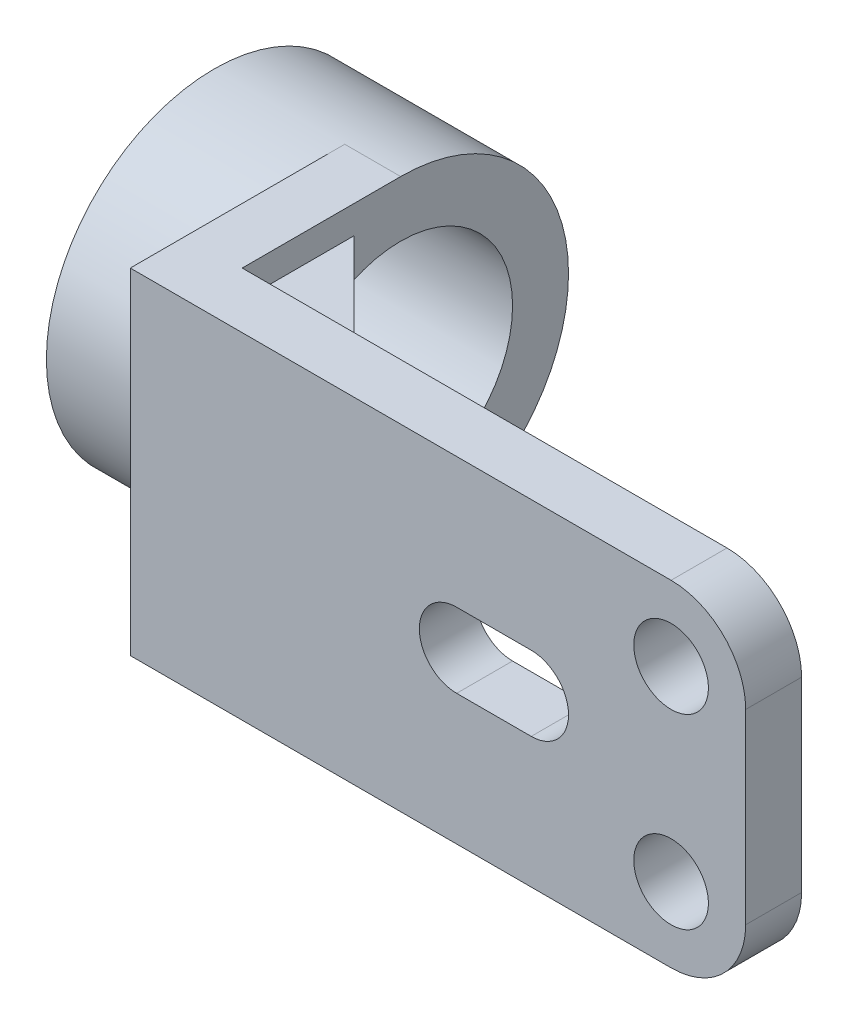
from build123d import *

# Parameters (mm, degrees)
BOSS_EXTRUDE1_DEPTH = 36
SKETCH2_W           = 16.184746641
SKETCH2_H           = 32
CUT_EXTRUDE1_DEPTH  = 36
CUT_EXTRUDE2_DEPTH  = 36
SKETCH4_3_R         = 12
CUT_EXTRUDE3_DEPTH  = 36
BOSS_EXTRUDE2_START = 14
SKETCH4_4_R         = 12
BOSS_EXTRUDE2_DEPTH = 14
SKETCH5_R           = 4
CUT_EXTRUDE4_DEPTH  = 14
FILLET2_R           = 8
SKETCH9_W           = 12
SKETCH9_H           = 4
BOSS_EXTRUDE3_DEPTH = 12
CUT_EXTRUDE5_DEPTH  = 53


with BuildPart() as part:
    # Sketch1 → Boss-Extrude1 (new body)
    with BuildSketch(Plane(origin=(0, 0, 0), x_dir=(1, 0, 0), z_dir=(0, 1, 0))):
        Polygon((0, 0), (66, 0), (66, 6), (6, 6), (6, 46), (-14, 46), (-14, 14), (0, 14), align=None)
    extrude(amount=BOSS_EXTRUDE1_DEPTH)

    # Sketch2 → Cut-Extrude1 (cut)
    with BuildSketch(Plane(origin=(0, 36, 0), x_dir=(1, 0, 0), z_dir=(0, 1, 0))):
        with Locations((-8.092373321, 30)):
            Rectangle(SKETCH2_W, SKETCH2_H)
    extrude(amount=-CUT_EXTRUDE1_DEPTH, mode=Mode.SUBTRACT)

    # Sketch4 → Cut-Extrude2 (cut)
    with BuildSketch(Plane.ZY):
        with BuildLine():
            ThreePointArc((-23, 0), (-41, 18), (-23, 36))
            Line((-23, 36), (-46, 36))
            Line((-46, 36), (-46, 0))
            Line((-46, 0), (-23, 0))
        make_face()
    extrude(amount=-CUT_EXTRUDE2_DEPTH, mode=Mode.SUBTRACT)

    # Sketch4<3> → Cut-Extrude3 (cut)
    with BuildSketch(Plane.ZY):
        with Locations((-23, 18)):
            Circle(SKETCH4_3_R)
    extrude(amount=-CUT_EXTRUDE3_DEPTH, mode=Mode.SUBTRACT)

    # Sketch4<4> → Boss-Extrude2 (add)
    with BuildSketch(Plane.ZY.offset(BOSS_EXTRUDE2_START)):
        with BuildLine():
            ThreePointArc((-5, 18), (-10.272077939, 30.727922061), (-23, 36))
            ThreePointArc((-23, 36), (-41, 18), (-23, 0))
            ThreePointArc((-23, 0), (-10.272077939, 5.272077939), (-5, 18))
        make_face()
        with Locations((-23, 18)):
            Circle(SKETCH4_4_R, mode=Mode.SUBTRACT)
    extrude(amount=-BOSS_EXTRUDE2_DEPTH)

    # Sketch5 → Cut-Extrude4 (cut)
    with BuildSketch(Plane(origin=(0, 0, -6), x_dir=(-1, 0, 0), z_dir=(0, 0, -1))):
        with Locations((-58, 28)):
            Circle(SKETCH5_R)
        with Locations((-58, 8)):
            Circle(SKETCH5_R)
        with BuildLine():
            Line((-43, 22), (-35, 22))
            ThreePointArc((-35, 22), (-31, 18), (-35, 14))
            Line((-35, 14), (-43, 14))
            ThreePointArc((-43, 14), (-47, 18), (-43, 22))
        make_face()
    extrude(amount=-CUT_EXTRUDE4_DEPTH, mode=Mode.SUBTRACT)

    # Fillet2
    fillet2_edges = [part.edges().sort_by_distance(p)[0] for p in [
        (66, 36, -3),
        (66, 0, -3),
    ]]
    fillet(fillet2_edges, radius=FILLET2_R)

    # Sketch9 → Boss-Extrude3 (add)
    with BuildSketch(Plane(origin=(0, 0, -6), x_dir=(-1, 0, 0), z_dir=(0, 0, -1))):
        with Locations((-12, 31)):
            Rectangle(SKETCH9_W, SKETCH9_H)
        with Locations((-12, 5)):
            Rectangle(SKETCH9_W, SKETCH9_H)
    extrude(amount=BOSS_EXTRUDE3_DEPTH)

    # Sketch10 → Cut-Extrude5 (cut)
    with BuildSketch(Plane.XZ.offset(-3)):
        Polygon((18, -6), (6, -18), (14.583968048, -28.688637826), (24.603794653, -16.204919433), align=None)
    extrude(amount=-CUT_EXTRUDE5_DEPTH, mode=Mode.SUBTRACT)


solid = part.part
